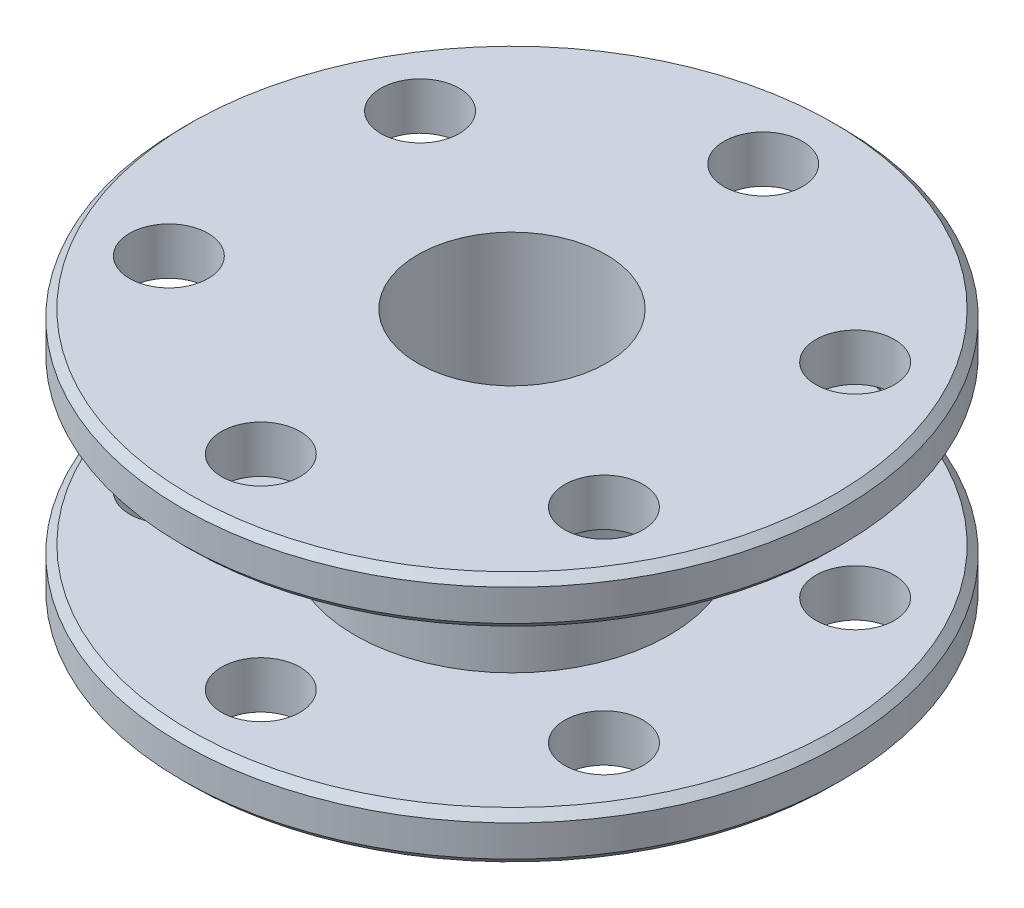
from build123d import *

# Parameters (mm, degrees)
SKETCH1_R           = 21
SKETCH1_R_2         = 6
SKETCH1_R_3         = 2.5
BOSS_EXTRUDE1_DEPTH = 16
SKETCH2_W           = 16.32773843
SKETCH2_H           = 10
CHAMFER1_SIZE       = 0.5


with BuildPart() as part:
    # Sketch1 → Boss-Extrude1 (new body)
    with BuildSketch(Plane(origin=(0, 0, 0), x_dir=(1, 0, 0), z_dir=(0, 1, 0))):
        with Locations(Location((0, 0, 0), (0, 0, 270))):
            Circle(SKETCH1_R)
        with Locations(Location((0, 0, 0), (0, 0, 270))):
            Circle(SKETCH1_R_2, mode=Mode.SUBTRACT)
        with Locations(Location((0, 16, 0), (0, 0, 270))):
            Circle(SKETCH1_R_3, mode=Mode.SUBTRACT)
        with Locations(Location((13.856406461, 8, 0), (0, 0, 270))):
            Circle(SKETCH1_R_3, mode=Mode.SUBTRACT)
        with Locations(Location((13.856406461, -8, 0), (0, 0, 270))):
            Circle(SKETCH1_R_3, mode=Mode.SUBTRACT)
        with Locations(Location((0, -16, 0), (0, 0, 270))):
            Circle(SKETCH1_R_3, mode=Mode.SUBTRACT)
        with Locations(Location((-13.856406461, -8, 0), (0, 0, 270))):
            Circle(SKETCH1_R_3, mode=Mode.SUBTRACT)
        with Locations(Location((-13.856406461, 8, 0), (0, 0, 270))):
            Circle(SKETCH1_R_3, mode=Mode.SUBTRACT)
    extrude(amount=BOSS_EXTRUDE1_DEPTH)

    # Sketch2 → Cut-Revolve1 (revolve, cut)
    with BuildSketch(Plane(origin=(0, 0, 0), x_dir=(0, 0, -1), z_dir=(1, 0, 0))):
        with Locations((18.163869215, 8)):
            Rectangle(SKETCH2_W, SKETCH2_H)
    revolve(axis=Axis((0, 0, 0), (0, 1, 0)), mode=Mode.SUBTRACT)

    # Chamfer1
    chamfer1_edges = [part.edges().sort_by_distance(p)[0] for p in [
        (0, 0, -21),
        (0, 3, -21),
        (0, 13, -21),
        (0, 16, -21),
    ]]
    chamfer(chamfer1_edges, length=CHAMFER1_SIZE)


solid = part.part
